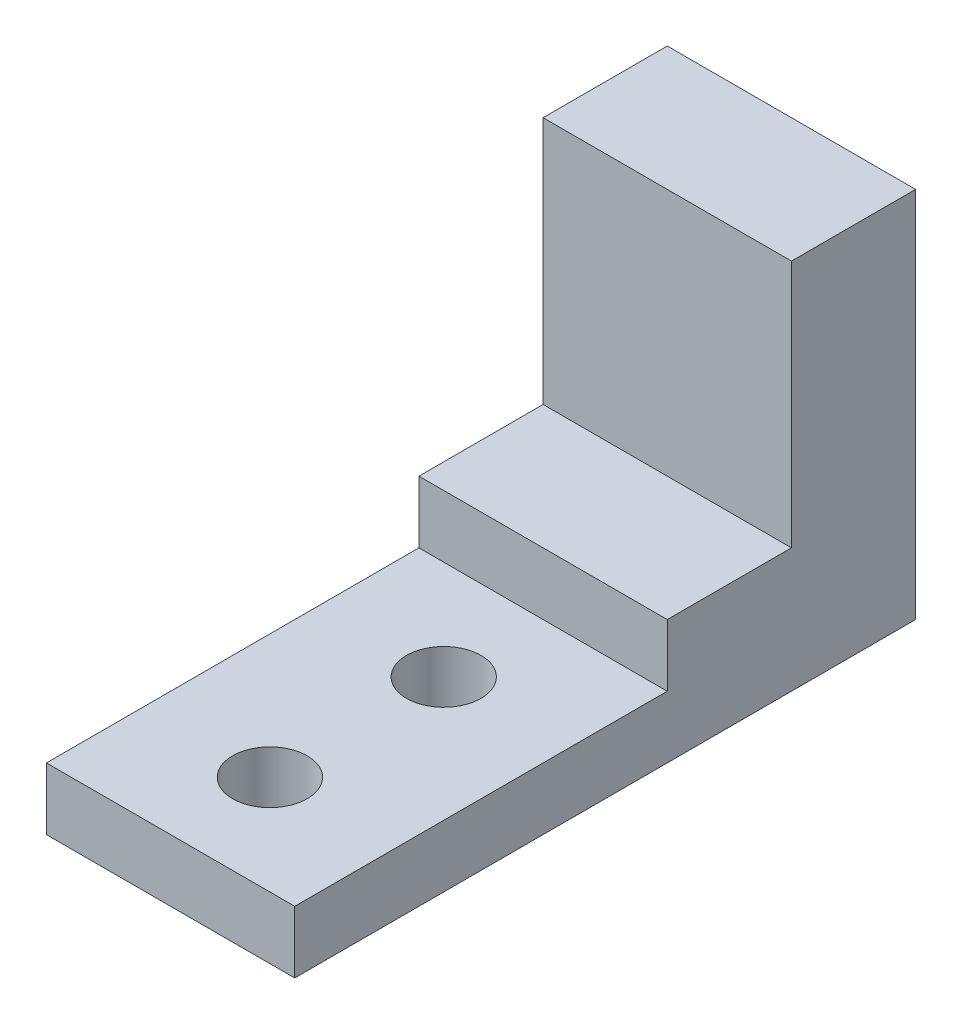
from build123d import *

# Parameters (mm, degrees)
SKETCH1_W           = 10
SKETCH1_H           = 2.5
BOSS_EXTRUDE1_DEPTH = 15
SKETCH2_R           = 1.5
CUT_EXTRUDE1_DEPTH  = 15
SKETCH3_W           = 10
SKETCH3_H           = 5
BOSS_EXTRUDE2_DEPTH = 10
SKETCH4_W           = 10
SKETCH4_H           = 5
BOSS_EXTRUDE3_DEPTH = 10


with BuildPart() as part:
    # Sketch1 → Boss-Extrude1 (new body)
    with BuildSketch(Plane.XY):
        with Locations((5, -1.25)):
            Rectangle(SKETCH1_W, SKETCH1_H)
    extrude(amount=BOSS_EXTRUDE1_DEPTH)

    # Sketch2 → Cut-Extrude1 (cut)
    with BuildSketch(Plane(origin=(0, 0, 0), x_dir=(1, 0, 0), z_dir=(0, 1, 0))):
        with Locations(Location((5, -11, 0), (0, 0, 270))):
            Circle(SKETCH2_R)
        with Locations(Location((5, -4, 0), (0, 0, 270))):
            Circle(SKETCH2_R)
    extrude(amount=-CUT_EXTRUDE1_DEPTH, mode=Mode.SUBTRACT)

    # Sketch3 → Boss-Extrude2 (add)
    with BuildSketch(Plane(origin=(0, 0, 0), x_dir=(-1, 0, 0), z_dir=(0, 0, -1))):
        with Locations((-5, 0)):
            Rectangle(SKETCH3_W, SKETCH3_H)
    extrude(amount=BOSS_EXTRUDE2_DEPTH)

    # Sketch4 → Boss-Extrude3 (add)
    with BuildSketch(Plane(origin=(0, 2.5, 0), x_dir=(1, 0, 0), z_dir=(0, 1, 0))):
        with Locations((5, 7.5)):
            Rectangle(SKETCH4_W, SKETCH4_H)
    extrude(amount=BOSS_EXTRUDE3_DEPTH)


solid = part.part
